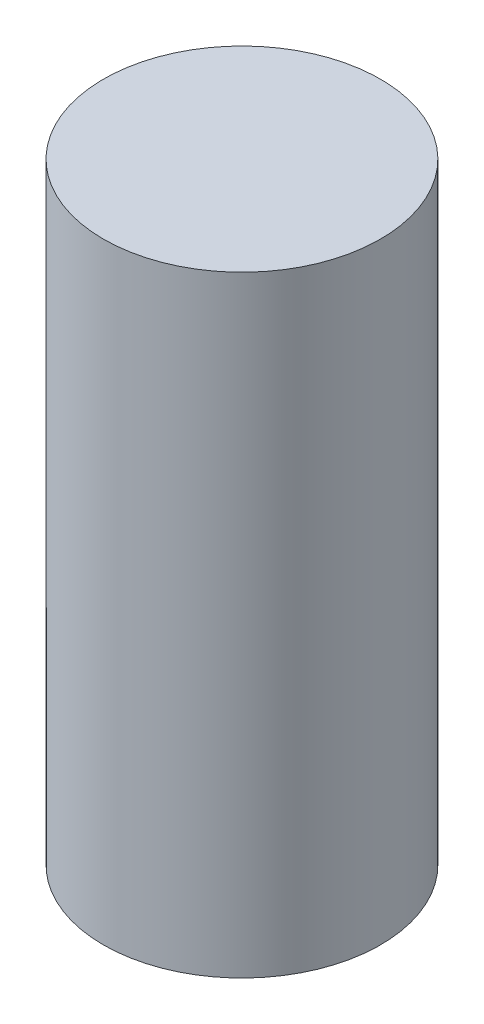
from build123d import *

# Parameters (mm, degrees)
SKETCH3_R           = 68
BOSS_EXTRUDE1_DEPTH = 300


with BuildPart() as part:
    # Sketch3 → Boss-Extrude1 (new body)
    with BuildSketch(Plane(origin=(0, 0, 0), x_dir=(1, 0, 0), z_dir=(0, 1, 0))):
        with Locations(Location((0, 0, 0), (0, 0, 270))):
            Circle(SKETCH3_R)
    extrude(amount=BOSS_EXTRUDE1_DEPTH)


solid = part.part
